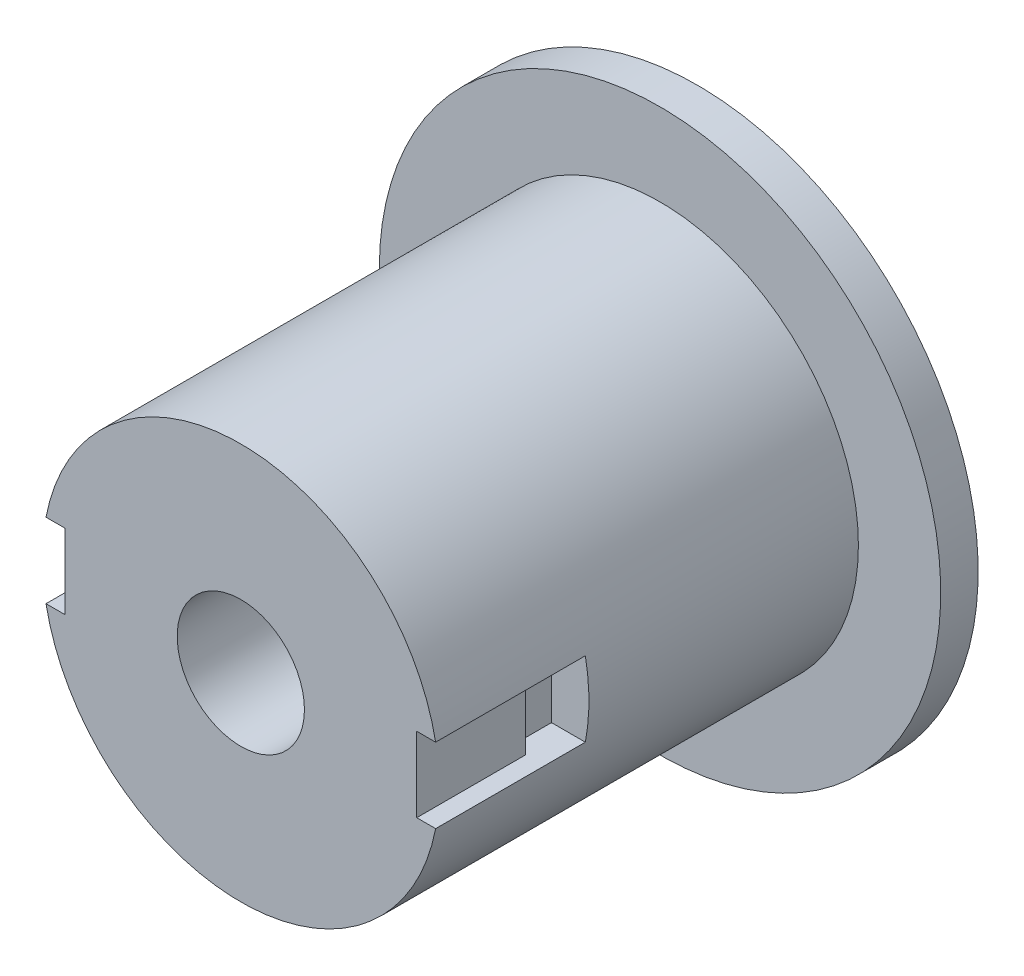
from build123d import *

# Parameters (mm, degrees)
SKETCH1_R           = 26.5
BOSS_EXTRUDE1_DEPTH = 56
SKETCH4_R           = 37.5
BOSS_EXTRUDE2_DEPTH = 5
SKETCH5_R           = 8.5
CUT_EXTRUDE1_DEPTH  = 81.830068663
CUT_EXTRUDE2_DEPTH  = 5


with BuildPart() as part:
    # Sketch1 → Boss-Extrude1 (new body)
    with BuildSketch(Plane.XY):
        Circle(SKETCH1_R)
    extrude(amount=BOSS_EXTRUDE1_DEPTH)

    # Sketch4 → Boss-Extrude2 (add)
    with BuildSketch(Plane(origin=(0, 0, 0), x_dir=(-1, 0, 0), z_dir=(0, 0, -1))):
        Circle(SKETCH4_R)
    extrude(amount=BOSS_EXTRUDE2_DEPTH)

    # Sketch5 → Cut-Extrude1 (cut, through all)
    with BuildSketch(Plane.XY.offset(56)):
        Circle(SKETCH5_R)
    extrude(amount=-CUT_EXTRUDE1_DEPTH, mode=Mode.SUBTRACT)

    # Sketch6 → Cut-Extrude2 (cut, symmetric)
    with BuildSketch(Plane(origin=(0, 0, 0), x_dir=(1, 0, 0), z_dir=(0, 1, 0))):
        Polygon((23.5, -56), (26.5, -56), (26.5, -36), (21.5, -36), (21.5, -39.5), (23.5, -41.5), align=None)
    cut_extrude2 = extrude(amount=CUT_EXTRUDE2_DEPTH, both=True, mode=Mode.SUBTRACT)

    # Mirror1: Cut-Extrude2 across plane
    add(cut_extrude2.mirror(Plane(origin=(0, 0, 0), x_dir=(0, 0, 1), z_dir=(1, 0, 0))), mode=Mode.SUBTRACT)


solid = part.part
